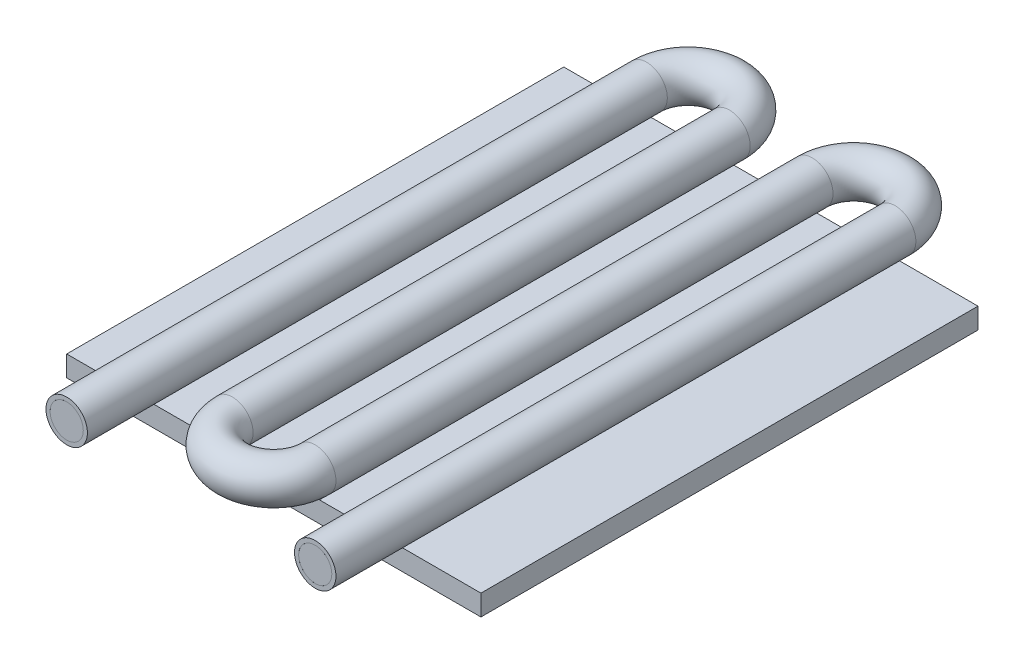
from build123d import *

# Parameters (mm, degrees)
SKETCH1_W               = 200
SKETCH1_H               = 240
BOSS_EXTRUDE1_DEPTH     = 10
SWEEP_THIN1_PROFILE_R   = 10
SWEEP_THIN1_PROFILE_R_2 = 8
SKETCH16_W              = 4
SKETCH16_H              = 3
BOSS_EXTRUDE2_DEPTH     = 240
SKETCH17_R              = 8
LID_1_DEPTH             = 5
SKETCH17_3_R            = 8
LID_2_DEPTH             = 5


with BuildPart() as part:
    # Sketch1 → Boss-Extrude1 (new body)
    with BuildSketch(Plane(origin=(0, 0, 0), x_dir=(1, 0, 0), z_dir=(0, 1, 0))):
        Rectangle(SKETCH1_W, SKETCH1_H)
    extrude(amount=BOSS_EXTRUDE1_DEPTH)



with BuildPart() as body_2:
    # Sweep-Thin1: sweep along a path in Sketch2
    with BuildLine(Plane(origin=(0, 22, 0), x_dir=(1, 0, 0), z_dir=(0, 1, 0))) as sweep_thin1_path:
        Line((-60, -160), (-60, 120))
        ThreePointArc((-60, 120), (-40, 140), (-20, 120))
        Line((-20, 120), (-20, -120))
        ThreePointArc((-20, -120), (0, -140), (20, -120))
        Line((20, -120), (20, 120))
        ThreePointArc((20, 120), (40, 140), (60, 120))
        Line((60, 120), (60, -160))
    # Sweep-Thin1 profile (on start of the path) → Sweep-Thin1 (sweep)
    with BuildSketch(Plane(origin=(-60, 22, 160), x_dir=(-1, 0, 0), z_dir=(0, 0, -1))):
        Circle(SWEEP_THIN1_PROFILE_R)
        Circle(SWEEP_THIN1_PROFILE_R_2, mode=Mode.SUBTRACT)
    sweep(path=sweep_thin1_path.line)


with BuildPart() as part_1:
    add(part.part)

    add(body_2.part)  # Boss-Extrude2 merges body 2
    # Sketch16 → Boss-Extrude2 (add)
    with BuildSketch(Plane.XY.offset(120)):
        with Locations((-60, 11.5)):
            Rectangle(SKETCH16_W, SKETCH16_H)
        with Locations((60, 11.5)):
            Rectangle(SKETCH16_W, SKETCH16_H)
        with Locations((-20, 11.5)):
            Rectangle(SKETCH16_W, SKETCH16_H)
        with Locations((20, 11.5)):
            Rectangle(SKETCH16_W, SKETCH16_H)
    extrude(amount=-BOSS_EXTRUDE2_DEPTH)


with BuildPart() as body_2_2:
    # Sketch17 → Lid 1 (new body)
    with BuildSketch(Plane.XY.offset(160)):
        with Locations((-60, 22)):
            Circle(SKETCH17_R)
    extrude(amount=-LID_1_DEPTH)


with BuildPart() as body_3:
    # Sketch17<3> → Lid 2 (new body)
    with BuildSketch(Plane.XY.offset(160)):
        with Locations((60, 22)):
            Circle(SKETCH17_3_R)
    extrude(amount=-LID_2_DEPTH)


solid = Compound([part_1.part, body_2_2.part, body_3.part])
